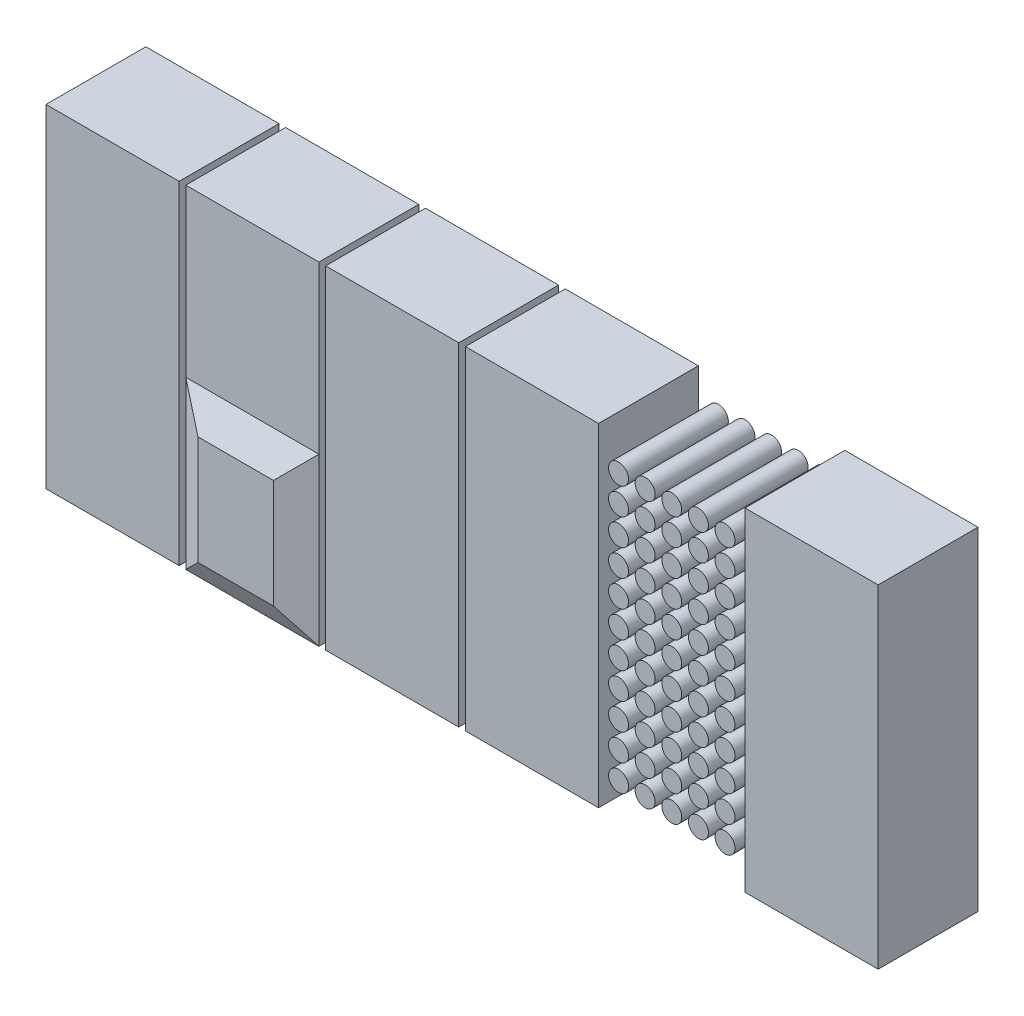
from build123d import *

# Parameters (mm, degrees)
SKETCH2_W              = 2000
SKETCH2_H              = 5000
BOSS_EXTRUDE1_DEPTH    = 1500
BOSS_EXTRUDE1_2_DEPTH  = 1500
BOSS_EXTRUDE1_3_DEPTH  = 1500
BOSS_EXTRUDE1_4_DEPTH  = 1500
BOSS_EXTRUDE1_5_DEPTH  = 1500
SKETCH2_R              = 150
BOSS_EXTRUDE1_6_DEPTH  = 1500
BOSS_EXTRUDE1_7_DEPTH  = 1500
BOSS_EXTRUDE1_8_DEPTH  = 1500
BOSS_EXTRUDE1_9_DEPTH  = 1500
BOSS_EXTRUDE1_10_DEPTH = 1500
BOSS_EXTRUDE1_11_DEPTH = 1500
BOSS_EXTRUDE1_12_DEPTH = 1500
BOSS_EXTRUDE1_13_DEPTH = 1500
BOSS_EXTRUDE1_14_DEPTH = 1500
BOSS_EXTRUDE1_15_DEPTH = 1500
BOSS_EXTRUDE1_16_DEPTH = 1500
BOSS_EXTRUDE1_17_DEPTH = 1500
BOSS_EXTRUDE1_18_DEPTH = 1500
BOSS_EXTRUDE1_19_DEPTH = 1500
BOSS_EXTRUDE1_20_DEPTH = 1500
BOSS_EXTRUDE1_21_DEPTH = 1500
BOSS_EXTRUDE1_22_DEPTH = 1500
BOSS_EXTRUDE1_23_DEPTH = 1500
BOSS_EXTRUDE1_24_DEPTH = 1500
BOSS_EXTRUDE1_25_DEPTH = 1500
BOSS_EXTRUDE1_26_DEPTH = 1500
BOSS_EXTRUDE1_27_DEPTH = 1500
BOSS_EXTRUDE1_28_DEPTH = 1500
BOSS_EXTRUDE1_29_DEPTH = 1500
BOSS_EXTRUDE1_30_DEPTH = 1500
BOSS_EXTRUDE1_31_DEPTH = 1500
BOSS_EXTRUDE1_32_DEPTH = 1500
BOSS_EXTRUDE1_33_DEPTH = 1500
BOSS_EXTRUDE1_34_DEPTH = 1500
BOSS_EXTRUDE1_35_DEPTH = 1500
BOSS_EXTRUDE1_36_DEPTH = 1500
BOSS_EXTRUDE1_37_DEPTH = 1500
BOSS_EXTRUDE1_38_DEPTH = 1500
BOSS_EXTRUDE1_39_DEPTH = 1500
BOSS_EXTRUDE1_40_DEPTH = 1500
BOSS_EXTRUDE1_41_DEPTH = 1500
BOSS_EXTRUDE1_42_DEPTH = 1500
BOSS_EXTRUDE1_43_DEPTH = 1500
BOSS_EXTRUDE1_44_DEPTH = 1500
BOSS_EXTRUDE1_45_DEPTH = 1500
BOSS_EXTRUDE1_46_DEPTH = 1500
BOSS_EXTRUDE1_47_DEPTH = 1500
BOSS_EXTRUDE1_48_DEPTH = 1500
BOSS_EXTRUDE1_49_DEPTH = 1500
BOSS_EXTRUDE1_50_DEPTH = 1500
BOSS_EXTRUDE1_51_DEPTH = 1500
BOSS_EXTRUDE1_52_DEPTH = 1500
BOSS_EXTRUDE1_53_DEPTH = 1500
BOSS_EXTRUDE1_54_DEPTH = 1500
BOSS_EXTRUDE1_55_DEPTH = 1500
BOSS_EXTRUDE1_56_DEPTH = 1500
BOSS_EXTRUDE1_57_DEPTH = 1500
BOSS_EXTRUDE1_58_DEPTH = 1500
BOSS_EXTRUDE1_59_DEPTH = 1500
BOSS_EXTRUDE1_60_DEPTH = 1500
SKETCH3_W              = 2000
SKETCH3_H              = 2500
BOSS_EXTRUDE2_DEPTH    = 250
BOSS_EXTRUDE2_TAPER    = 60


with BuildPart() as part:
    # Sketch2 → Boss-Extrude1 (new body)
    with BuildSketch(Plane.XY):
        Rectangle(SKETCH2_W, SKETCH2_H)
    extrude(amount=BOSS_EXTRUDE1_DEPTH)


with BuildPart() as body_2:
    # Sketch2 → Boss-Extrude1 2 (new body)
    with BuildSketch(Plane.XY):
        with Locations((2100, 0)):
            Rectangle(SKETCH2_W, SKETCH2_H)
    extrude(amount=BOSS_EXTRUDE1_2_DEPTH)

    # Sketch3 → Boss-Extrude2 (add)
    with BuildSketch(Plane.XY.offset(1500)):
        with Locations((2100, -1250)):
            Rectangle(SKETCH3_W, SKETCH3_H)
    extrude(amount=BOSS_EXTRUDE2_DEPTH, taper=BOSS_EXTRUDE2_TAPER)


with BuildPart() as body_3:
    # Sketch2 → Boss-Extrude1 3 (new body)
    with BuildSketch(Plane.XY):
        with Locations((4200, 0)):
            Rectangle(SKETCH2_W, SKETCH2_H)
    extrude(amount=BOSS_EXTRUDE1_3_DEPTH)


with BuildPart() as body_4:
    # Sketch2 → Boss-Extrude1 4 (new body)
    with BuildSketch(Plane.XY):
        with Locations((6300, 0)):
            Rectangle(SKETCH2_W, SKETCH2_H)
    extrude(amount=BOSS_EXTRUDE1_4_DEPTH)


with BuildPart() as body_5:
    # Sketch2 → Boss-Extrude1 5 (new body)
    with BuildSketch(Plane.XY):
        with Locations((10500, 0)):
            Rectangle(SKETCH2_W, SKETCH2_H)
    extrude(amount=BOSS_EXTRUDE1_5_DEPTH)


with BuildPart() as body_6:
    # Sketch2 → Boss-Extrude1 6 (new body)
    with BuildSketch(Plane.XY):
        with Locations((7600, -2000)):
            Circle(SKETCH2_R)
    extrude(amount=BOSS_EXTRUDE1_6_DEPTH)


with BuildPart() as body_7:
    # Sketch2 → Boss-Extrude1 7 (new body)
    with BuildSketch(Plane.XY):
        with Locations((7600, -1600)):
            Circle(SKETCH2_R)
    extrude(amount=BOSS_EXTRUDE1_7_DEPTH)


with BuildPart() as body_8:
    # Sketch2 → Boss-Extrude1 8 (new body)
    with BuildSketch(Plane.XY):
        with Locations((7600, -1200)):
            Circle(SKETCH2_R)
    extrude(amount=BOSS_EXTRUDE1_8_DEPTH)


with BuildPart() as body_9:
    # Sketch2 → Boss-Extrude1 9 (new body)
    with BuildSketch(Plane.XY):
        with Locations((7600, -800)):
            Circle(SKETCH2_R)
    extrude(amount=BOSS_EXTRUDE1_9_DEPTH)


with BuildPart() as body_10:
    # Sketch2 → Boss-Extrude1 10 (new body)
    with BuildSketch(Plane.XY):
        with Locations((7600, -400)):
            Circle(SKETCH2_R)
    extrude(amount=BOSS_EXTRUDE1_10_DEPTH)


with BuildPart() as body_11:
    # Sketch2 → Boss-Extrude1 11 (new body)
    with BuildSketch(Plane.XY):
        with Locations((7600, 0)):
            Circle(SKETCH2_R)
    extrude(amount=BOSS_EXTRUDE1_11_DEPTH)


with BuildPart() as body_12:
    # Sketch2 → Boss-Extrude1 12 (new body)
    with BuildSketch(Plane.XY):
        with Locations((7600, 400)):
            Circle(SKETCH2_R)
    extrude(amount=BOSS_EXTRUDE1_12_DEPTH)


with BuildPart() as body_13:
    # Sketch2 → Boss-Extrude1 13 (new body)
    with BuildSketch(Plane.XY):
        with Locations((7600, 800)):
            Circle(SKETCH2_R)
    extrude(amount=BOSS_EXTRUDE1_13_DEPTH)


with BuildPart() as body_14:
    # Sketch2 → Boss-Extrude1 14 (new body)
    with BuildSketch(Plane.XY):
        with Locations((7600, 1200)):
            Circle(SKETCH2_R)
    extrude(amount=BOSS_EXTRUDE1_14_DEPTH)


with BuildPart() as body_15:
    # Sketch2 → Boss-Extrude1 15 (new body)
    with BuildSketch(Plane.XY):
        with Locations((7600, 1600)):
            Circle(SKETCH2_R)
    extrude(amount=BOSS_EXTRUDE1_15_DEPTH)


with BuildPart() as body_16:
    # Sketch2 → Boss-Extrude1 16 (new body)
    with BuildSketch(Plane.XY):
        with Locations((8000, 1600)):
            Circle(SKETCH2_R)
    extrude(amount=BOSS_EXTRUDE1_16_DEPTH)


with BuildPart() as body_17:
    # Sketch2 → Boss-Extrude1 17 (new body)
    with BuildSketch(Plane.XY):
        with Locations((8000, 2000)):
            Circle(SKETCH2_R)
    extrude(amount=BOSS_EXTRUDE1_17_DEPTH)


with BuildPart() as body_18:
    # Sketch2 → Boss-Extrude1 18 (new body)
    with BuildSketch(Plane.XY):
        with Locations((8000, 1200)):
            Circle(SKETCH2_R)
    extrude(amount=BOSS_EXTRUDE1_18_DEPTH)


with BuildPart() as body_19:
    # Sketch2 → Boss-Extrude1 19 (new body)
    with BuildSketch(Plane.XY):
        with Locations((8000, 800)):
            Circle(SKETCH2_R)
    extrude(amount=BOSS_EXTRUDE1_19_DEPTH)


with BuildPart() as body_20:
    # Sketch2 → Boss-Extrude1 20 (new body)
    with BuildSketch(Plane.XY):
        with Locations((8000, 400)):
            Circle(SKETCH2_R)
    extrude(amount=BOSS_EXTRUDE1_20_DEPTH)


with BuildPart() as body_21:
    # Sketch2 → Boss-Extrude1 21 (new body)
    with BuildSketch(Plane.XY):
        with Locations((8000, 0)):
            Circle(SKETCH2_R)
    extrude(amount=BOSS_EXTRUDE1_21_DEPTH)


with BuildPart() as body_22:
    # Sketch2 → Boss-Extrude1 22 (new body)
    with BuildSketch(Plane.XY):
        with Locations((8000, -400)):
            Circle(SKETCH2_R)
    extrude(amount=BOSS_EXTRUDE1_22_DEPTH)


with BuildPart() as body_23:
    # Sketch2 → Boss-Extrude1 23 (new body)
    with BuildSketch(Plane.XY):
        with Locations((8000, -800)):
            Circle(SKETCH2_R)
    extrude(amount=BOSS_EXTRUDE1_23_DEPTH)


with BuildPart() as body_24:
    # Sketch2 → Boss-Extrude1 24 (new body)
    with BuildSketch(Plane.XY):
        with Locations((8000, -1200)):
            Circle(SKETCH2_R)
    extrude(amount=BOSS_EXTRUDE1_24_DEPTH)


with BuildPart() as body_25:
    # Sketch2 → Boss-Extrude1 25 (new body)
    with BuildSketch(Plane.XY):
        with Locations((8000, -1600)):
            Circle(SKETCH2_R)
    extrude(amount=BOSS_EXTRUDE1_25_DEPTH)


with BuildPart() as body_26:
    # Sketch2 → Boss-Extrude1 26 (new body)
    with BuildSketch(Plane.XY):
        with Locations((8000, -2000)):
            Circle(SKETCH2_R)
    extrude(amount=BOSS_EXTRUDE1_26_DEPTH)


with BuildPart() as body_27:
    # Sketch2 → Boss-Extrude1 27 (new body)
    with BuildSketch(Plane.XY):
        with Locations((8400, -2000)):
            Circle(SKETCH2_R)
    extrude(amount=BOSS_EXTRUDE1_27_DEPTH)


with BuildPart() as body_28:
    # Sketch2 → Boss-Extrude1 28 (new body)
    with BuildSketch(Plane.XY):
        with Locations((8400, -1200)):
            Circle(SKETCH2_R)
    extrude(amount=BOSS_EXTRUDE1_28_DEPTH)


with BuildPart() as body_29:
    # Sketch2 → Boss-Extrude1 29 (new body)
    with BuildSketch(Plane.XY):
        with Locations((8400, -800)):
            Circle(SKETCH2_R)
    extrude(amount=BOSS_EXTRUDE1_29_DEPTH)


with BuildPart() as body_30:
    # Sketch2 → Boss-Extrude1 30 (new body)
    with BuildSketch(Plane.XY):
        with Locations((8400, -400)):
            Circle(SKETCH2_R)
    extrude(amount=BOSS_EXTRUDE1_30_DEPTH)


with BuildPart() as body_31:
    # Sketch2 → Boss-Extrude1 31 (new body)
    with BuildSketch(Plane.XY):
        with Locations((8400, 400)):
            Circle(SKETCH2_R)
    extrude(amount=BOSS_EXTRUDE1_31_DEPTH)


with BuildPart() as body_32:
    # Sketch2 → Boss-Extrude1 32 (new body)
    with BuildSketch(Plane.XY):
        with Locations((8400, 800)):
            Circle(SKETCH2_R)
    extrude(amount=BOSS_EXTRUDE1_32_DEPTH)


with BuildPart() as body_33:
    # Sketch2 → Boss-Extrude1 33 (new body)
    with BuildSketch(Plane.XY):
        with Locations((8400, 1200)):
            Circle(SKETCH2_R)
    extrude(amount=BOSS_EXTRUDE1_33_DEPTH)


with BuildPart() as body_34:
    # Sketch2 → Boss-Extrude1 34 (new body)
    with BuildSketch(Plane.XY):
        with Locations((8400, 1600)):
            Circle(SKETCH2_R)
    extrude(amount=BOSS_EXTRUDE1_34_DEPTH)


with BuildPart() as body_35:
    # Sketch2 → Boss-Extrude1 35 (new body)
    with BuildSketch(Plane.XY):
        with Locations((8400, 2000)):
            Circle(SKETCH2_R)
    extrude(amount=BOSS_EXTRUDE1_35_DEPTH)


with BuildPart() as body_36:
    # Sketch2 → Boss-Extrude1 36 (new body)
    with BuildSketch(Plane.XY):
        with Locations((8800, 2000)):
            Circle(SKETCH2_R)
    extrude(amount=BOSS_EXTRUDE1_36_DEPTH)


with BuildPart() as body_37:
    # Sketch2 → Boss-Extrude1 37 (new body)
    with BuildSketch(Plane.XY):
        with Locations((8800, 1600)):
            Circle(SKETCH2_R)
    extrude(amount=BOSS_EXTRUDE1_37_DEPTH)


with BuildPart() as body_38:
    # Sketch2 → Boss-Extrude1 38 (new body)
    with BuildSketch(Plane.XY):
        with Locations((8800, 1200)):
            Circle(SKETCH2_R)
    extrude(amount=BOSS_EXTRUDE1_38_DEPTH)


with BuildPart() as body_39:
    # Sketch2 → Boss-Extrude1 39 (new body)
    with BuildSketch(Plane.XY):
        with Locations((8800, 800)):
            Circle(SKETCH2_R)
    extrude(amount=BOSS_EXTRUDE1_39_DEPTH)


with BuildPart() as body_40:
    # Sketch2 → Boss-Extrude1 40 (new body)
    with BuildSketch(Plane.XY):
        with Locations((8800, 400)):
            Circle(SKETCH2_R)
    extrude(amount=BOSS_EXTRUDE1_40_DEPTH)


with BuildPart() as body_41:
    # Sketch2 → Boss-Extrude1 41 (new body)
    with BuildSketch(Plane.XY):
        with Locations((8800, 0)):
            Circle(SKETCH2_R)
    extrude(amount=BOSS_EXTRUDE1_41_DEPTH)


with BuildPart() as body_42:
    # Sketch2 → Boss-Extrude1 42 (new body)
    with BuildSketch(Plane.XY):
        with Locations((8800, -1200)):
            Circle(SKETCH2_R)
    extrude(amount=BOSS_EXTRUDE1_42_DEPTH)


with BuildPart() as body_43:
    # Sketch2 → Boss-Extrude1 43 (new body)
    with BuildSketch(Plane.XY):
        with Locations((8800, -1600)):
            Circle(SKETCH2_R)
    extrude(amount=BOSS_EXTRUDE1_43_DEPTH)


with BuildPart() as body_44:
    # Sketch2 → Boss-Extrude1 44 (new body)
    with BuildSketch(Plane.XY):
        with Locations((8800, -2000)):
            Circle(SKETCH2_R)
    extrude(amount=BOSS_EXTRUDE1_44_DEPTH)


with BuildPart() as body_45:
    # Sketch2 → Boss-Extrude1 45 (new body)
    with BuildSketch(Plane.XY):
        with Locations((9200, -2000)):
            Circle(SKETCH2_R)
    extrude(amount=BOSS_EXTRUDE1_45_DEPTH)


with BuildPart() as body_46:
    # Sketch2 → Boss-Extrude1 46 (new body)
    with BuildSketch(Plane.XY):
        with Locations((9200, -1600)):
            Circle(SKETCH2_R)
    extrude(amount=BOSS_EXTRUDE1_46_DEPTH)


with BuildPart() as body_47:
    # Sketch2 → Boss-Extrude1 47 (new body)
    with BuildSketch(Plane.XY):
        with Locations((9200, -1200)):
            Circle(SKETCH2_R)
    extrude(amount=BOSS_EXTRUDE1_47_DEPTH)


with BuildPart() as body_48:
    # Sketch2 → Boss-Extrude1 48 (new body)
    with BuildSketch(Plane.XY):
        with Locations((9200, -400)):
            Circle(SKETCH2_R)
    extrude(amount=BOSS_EXTRUDE1_48_DEPTH)


with BuildPart() as body_49:
    # Sketch2 → Boss-Extrude1 49 (new body)
    with BuildSketch(Plane.XY):
        with Locations((9200, 400)):
            Circle(SKETCH2_R)
    extrude(amount=BOSS_EXTRUDE1_49_DEPTH)


with BuildPart() as body_50:
    # Sketch2 → Boss-Extrude1 50 (new body)
    with BuildSketch(Plane.XY):
        with Locations((9200, 800)):
            Circle(SKETCH2_R)
    extrude(amount=BOSS_EXTRUDE1_50_DEPTH)


with BuildPart() as body_51:
    # Sketch2 → Boss-Extrude1 51 (new body)
    with BuildSketch(Plane.XY):
        with Locations((9200, 1200)):
            Circle(SKETCH2_R)
    extrude(amount=BOSS_EXTRUDE1_51_DEPTH)


with BuildPart() as body_52:
    # Sketch2 → Boss-Extrude1 52 (new body)
    with BuildSketch(Plane.XY):
        with Locations((9200, 1600)):
            Circle(SKETCH2_R)
    extrude(amount=BOSS_EXTRUDE1_52_DEPTH)


with BuildPart() as body_53:
    # Sketch2 → Boss-Extrude1 53 (new body)
    with BuildSketch(Plane.XY):
        with Locations(Location((7600, 2000, 0), (0, 0, 180))):
            Circle(SKETCH2_R)
    extrude(amount=BOSS_EXTRUDE1_53_DEPTH)


with BuildPart() as body_54:
    # Sketch2 → Boss-Extrude1 54 (new body)
    with BuildSketch(Plane.XY):
        with Locations(Location((8400, -1600, 0), (0, 0, 180))):
            Circle(SKETCH2_R)
    extrude(amount=BOSS_EXTRUDE1_54_DEPTH)


with BuildPart() as body_55:
    # Sketch2 → Boss-Extrude1 55 (new body)
    with BuildSketch(Plane.XY):
        with Locations((8400, 0)):
            Circle(SKETCH2_R)
    extrude(amount=BOSS_EXTRUDE1_55_DEPTH)


with BuildPart() as body_56:
    # Sketch2 → Boss-Extrude1 56 (new body)
    with BuildSketch(Plane.XY):
        with Locations(Location((8800, -400, 0), (0, 0, 180))):
            Circle(SKETCH2_R)
    extrude(amount=BOSS_EXTRUDE1_56_DEPTH)


with BuildPart() as body_57:
    # Sketch2 → Boss-Extrude1 57 (new body)
    with BuildSketch(Plane.XY):
        with Locations(Location((8800, -800, 0), (0, 0, 180))):
            Circle(SKETCH2_R)
    extrude(amount=BOSS_EXTRUDE1_57_DEPTH)


with BuildPart() as body_58:
    # Sketch2 → Boss-Extrude1 58 (new body)
    with BuildSketch(Plane.XY):
        with Locations(Location((9200, -800, 0), (0, 0, 180))):
            Circle(SKETCH2_R)
    extrude(amount=BOSS_EXTRUDE1_58_DEPTH)


with BuildPart() as body_59:
    # Sketch2 → Boss-Extrude1 59 (new body)
    with BuildSketch(Plane.XY):
        with Locations((9200, 0)):
            Circle(SKETCH2_R)
    extrude(amount=BOSS_EXTRUDE1_59_DEPTH)


with BuildPart() as body_60:
    # Sketch2 → Boss-Extrude1 60 (new body)
    with BuildSketch(Plane.XY):
        with Locations((9200, 2000)):
            Circle(SKETCH2_R)
    extrude(amount=BOSS_EXTRUDE1_60_DEPTH)


solid = Compound([part.part, body_2.part, body_3.part, body_4.part, body_5.part, body_6.part, body_7.part, body_8.part, body_9.part, body_10.part, body_11.part, body_12.part, body_13.part, body_14.part, body_15.part, body_16.part, body_17.part, body_18.part, body_19.part, body_20.part, body_21.part, body_22.part, body_23.part, body_24.part, body_25.part, body_26.part, body_27.part, body_28.part, body_29.part, body_30.part, body_31.part, body_32.part, body_33.part, body_34.part, body_35.part, body_36.part, body_37.part, body_38.part, body_39.part, body_40.part, body_41.part, body_42.part, body_43.part, body_44.part, body_45.part, body_46.part, body_47.part, body_48.part, body_49.part, body_50.part, body_51.part, body_52.part, body_53.part, body_54.part, body_55.part, body_56.part, body_57.part, body_58.part, body_59.part, body_60.part])
